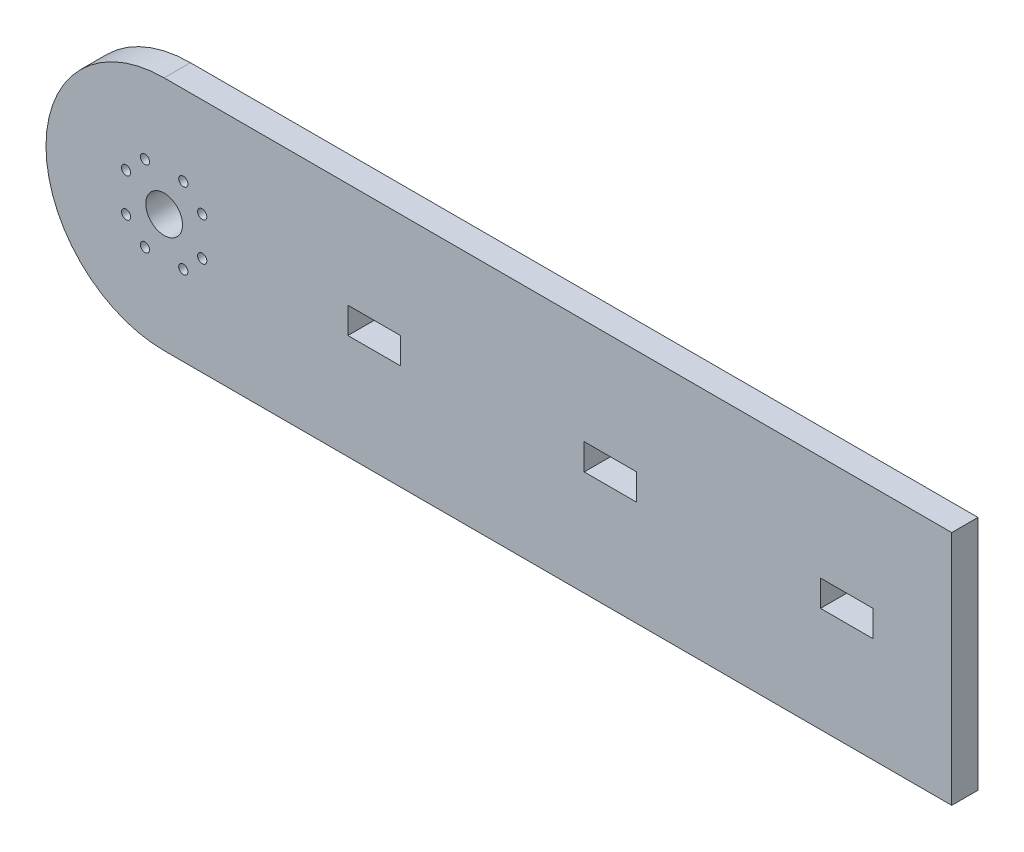
from build123d import *

# Parameters (mm, degrees)
ESQUISSE1_R        = 0.875
ESQUISSE1_R_2      = 3.5
ESQUISSE1_W        = 10
ESQUISSE1_H        = 5
BOSS_EXTRU_1_DEPTH = 5


with BuildPart() as part:
    # Esquisse1 → Boss.-Extru.1 (new body)
    with BuildSketch(Plane.XY):
        with BuildLine():
            Line((150, 22.5), (0, 22.5))
            ThreePointArc((0, 22.5), (-22.5, 0), (0, -22.5))
            Line((0, -22.5), (150, -22.5))
            Line((150, -22.5), (150, 22.5))
        make_face()
        with Locations((-3.65, -7.25)):
            Circle(ESQUISSE1_R, mode=Mode.SUBTRACT)
        with Locations((3.65, -7.25)):
            Circle(ESQUISSE1_R, mode=Mode.SUBTRACT)
        with Locations((-7.25, -3.65)):
            Circle(ESQUISSE1_R, mode=Mode.SUBTRACT)
        with Locations((7.25, -3.65)):
            Circle(ESQUISSE1_R, mode=Mode.SUBTRACT)
        with Locations((-7.25, 3.65)):
            Circle(ESQUISSE1_R, mode=Mode.SUBTRACT)
        Circle(ESQUISSE1_R_2, mode=Mode.SUBTRACT)
        with Locations((7.25, 3.65)):
            Circle(ESQUISSE1_R, mode=Mode.SUBTRACT)
        with Locations((-3.65, 7.25)):
            Circle(ESQUISSE1_R, mode=Mode.SUBTRACT)
        with Locations((3.65, 7.25)):
            Circle(ESQUISSE1_R, mode=Mode.SUBTRACT)
        with Locations((40, 0)):
            Rectangle(ESQUISSE1_W, ESQUISSE1_H, mode=Mode.SUBTRACT)
        with Locations((85, 0)):
            Rectangle(ESQUISSE1_W, ESQUISSE1_H, mode=Mode.SUBTRACT)
        with Locations((130, 0)):
            Rectangle(ESQUISSE1_W, ESQUISSE1_H, mode=Mode.SUBTRACT)
    extrude(amount=BOSS_EXTRU_1_DEPTH)


solid = part.part
